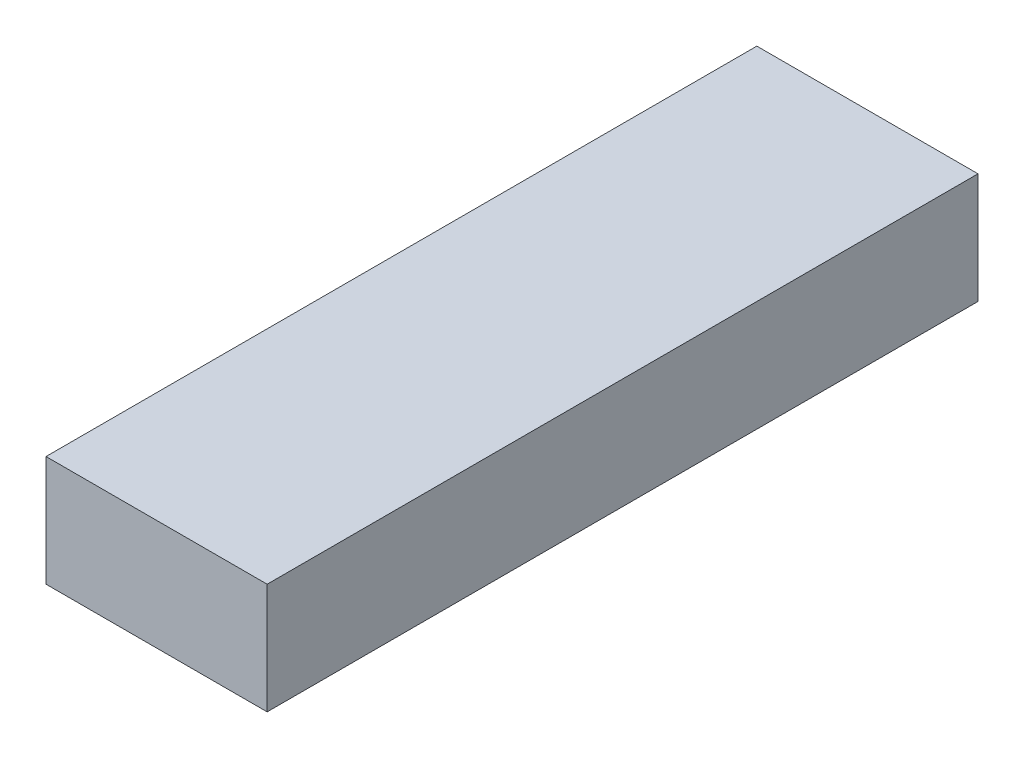
from build123d import *

# Parameters (mm, degrees)
SKETCH1_W           = 14
SKETCH1_H           = 7
BOSS_EXTRUDE1_DEPTH = 45


with BuildPart() as part:
    # Sketch1 → Boss-Extrude1 (new body)
    with BuildSketch(Plane.XY):
        with Locations((7, 3.5)):
            Rectangle(SKETCH1_W, SKETCH1_H)
    extrude(amount=BOSS_EXTRUDE1_DEPTH)


solid = part.part
